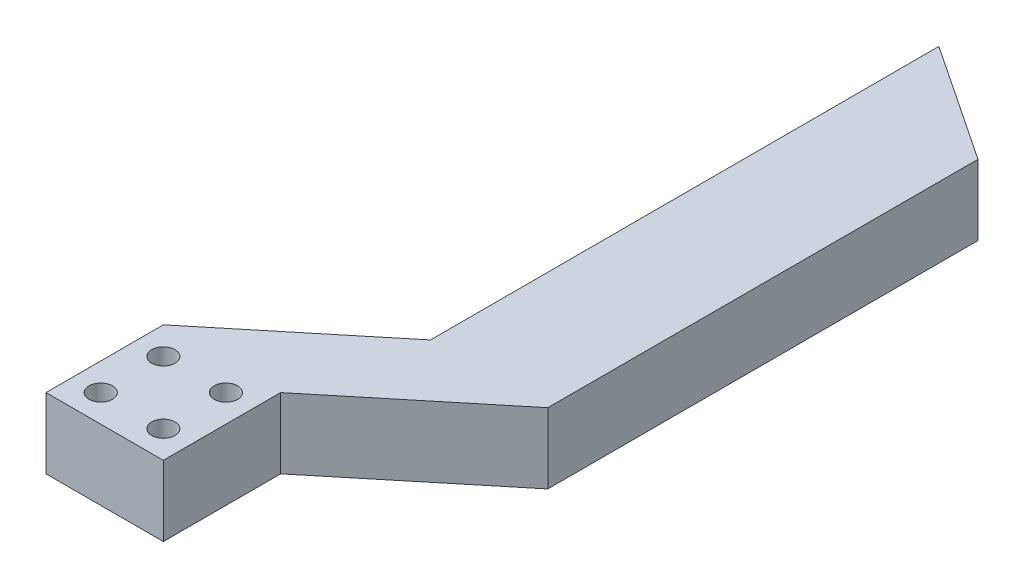
from build123d import *

# Parameters (mm, degrees)
CROQUIS1_R              = 1.5
SALIENTE_EXTRUIR1_DEPTH = 9


with BuildPart() as part:
    # Croquis1 → Saliente-Extruir1 (new body)
    with BuildSketch(Plane(origin=(0, 0, 0), x_dir=(1, 0, 0), z_dir=(0, 1, 0))):
        Polygon((7.75, 7.5), (26.5, 22.904273087), (26.5, 77.904273087), (26.5, 87.904273087), (41.5, 77.904273087), (41.5, 22.904273087), (22.75, 7.5), (22.75, -7.5), (7.75, -7.5), align=None)
        with Locations(Location((19.25, 4, 0), (0, 0, 270))):
            Circle(CROQUIS1_R, mode=Mode.SUBTRACT)
        with Locations(Location((19.25, -4, 0), (0, 0, 270))):
            Circle(CROQUIS1_R, mode=Mode.SUBTRACT)
        with Locations(Location((11.25, -4, 0), (0, 0, 270))):
            Circle(CROQUIS1_R, mode=Mode.SUBTRACT)
        with Locations(Location((11.25, 4, 0), (0, 0, 270))):
            Circle(CROQUIS1_R, mode=Mode.SUBTRACT)
    extrude(amount=SALIENTE_EXTRUIR1_DEPTH)


solid = part.part
